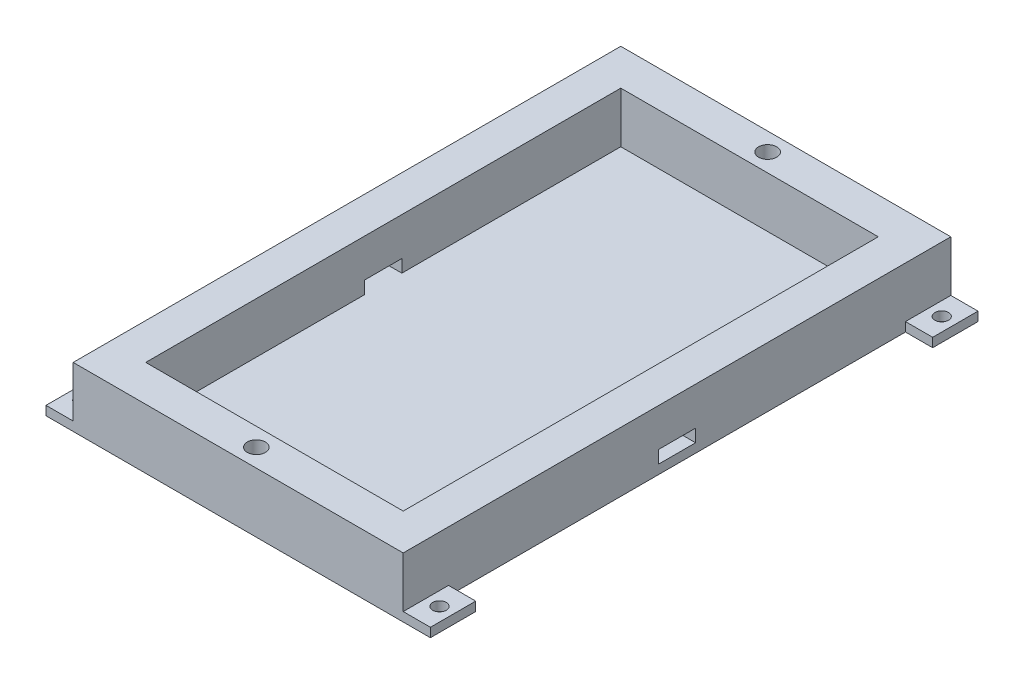
from build123d import *

# Parameters (mm, degrees)
ESBO_O1_W                = 36.4
ESBO_O1_H                = 60.4
ESBO_O1_W_2              = 28.4
ESBO_O1_H_2              = 52.4
RESSALTO_EXTRUS_O1_DEPTH = 6.6
ESBO_O2_W                = 28.4
ESBO_O2_H                = 52.4
RESSALTO_EXTRUS_O2_DEPTH = 1
ESBO_O4_W                = 4.1
ESBO_O4_H                = 1.4
CORTE_EXTRUS_O2_DEPTH    = 38
ESBO_O5_W                = 3
ESBO_O5_H                = 5
ESBO_O5_R                = 0.75
RESSALTO_EXTRUS_O3_DEPTH = 1
ESBO_O6_R                = 1
CORTE_EXTRUS_O3_DEPTH    = 4


with BuildPart() as part:
    # Esboço1 → Ressalto-extrusão1 (new body)
    with BuildSketch(Plane(origin=(0, 0, 0), x_dir=(1, 0, 0), z_dir=(0, 1, 0))):
        Rectangle(ESBO_O1_W, ESBO_O1_H)
        Rectangle(ESBO_O1_W_2, ESBO_O1_H_2, mode=Mode.SUBTRACT)
    extrude(amount=RESSALTO_EXTRUS_O1_DEPTH)

    # Esboço2 → Ressalto-extrusão2 (add)
    with BuildSketch(Plane(origin=(0, 0, 0), x_dir=(1, 0, 0), z_dir=(0, 1, 0))):
        Rectangle(ESBO_O2_W, ESBO_O2_H)
    extrude(amount=RESSALTO_EXTRUS_O2_DEPTH)

    # Esboço4 → Corte-extrusão2 (cut)
    with BuildSketch(Plane(origin=(18.2, 0, 0), x_dir=(0, 0, -1), z_dir=(1, 0, 0))):
        with Locations((0, 1.7)):
            Rectangle(ESBO_O4_W, ESBO_O4_H)
    extrude(amount=-CORTE_EXTRUS_O2_DEPTH, mode=Mode.SUBTRACT)

    # Esboço5 → Ressalto-extrusão3 (add)
    # profile 1 of 4: a face of its own
    with BuildSketch(Plane(origin=(0, 0, 0), x_dir=(1, 0, 0), z_dir=(0, 1, 0))):
        with Locations((-19.7, 27.7)):
            Rectangle(ESBO_O5_W, ESBO_O5_H)
        with Locations(Location((-19.7, 27.7, 0), (0, 0, 270))):
            Circle(ESBO_O5_R, mode=Mode.SUBTRACT)
    # profile 2 of 4: a face of its own
    with BuildSketch(Plane(origin=(0, 0, 0), x_dir=(1, 0, 0), z_dir=(0, 1, 0))):
        with Locations((-19.7, -27.7)):
            Rectangle(ESBO_O5_W, ESBO_O5_H)
        with Locations(Location((-19.7, -27.7, 0), (0, 0, 270))):
            Circle(ESBO_O5_R, mode=Mode.SUBTRACT)
    # profile 3 of 4: a face of its own
    with BuildSketch(Plane(origin=(0, 0, 0), x_dir=(1, 0, 0), z_dir=(0, 1, 0))):
        with Locations((19.7, -27.7)):
            Rectangle(ESBO_O5_W, ESBO_O5_H)
        with Locations(Location((19.7, -27.7, 0), (0, 0, 270))):
            Circle(ESBO_O5_R, mode=Mode.SUBTRACT)
    # profile 4 of 4: a face of its own
    with BuildSketch(Plane(origin=(0, 0, 0), x_dir=(1, 0, 0), z_dir=(0, 1, 0))):
        with Locations((19.7, 27.7)):
            Rectangle(ESBO_O5_W, ESBO_O5_H)
        with Locations(Location((19.7, 27.7, 0), (0, 0, 270))):
            Circle(ESBO_O5_R, mode=Mode.SUBTRACT)
    extrude(amount=RESSALTO_EXTRUS_O3_DEPTH)

    # Esboço6 → Corte-extrusão3 (cut)
    with BuildSketch(Plane(origin=(0, 6.6, 0), x_dir=(1, 0, 0), z_dir=(0, 1, 0))):
        with Locations(Location((0, 28.2, 0), (0, 0, 270))):
            Circle(ESBO_O6_R)
        with Locations(Location((0, -28.2, 0), (0, 0, 270))):
            Circle(ESBO_O6_R)
    extrude(amount=-CORTE_EXTRUS_O3_DEPTH, mode=Mode.SUBTRACT)


solid = part.part
